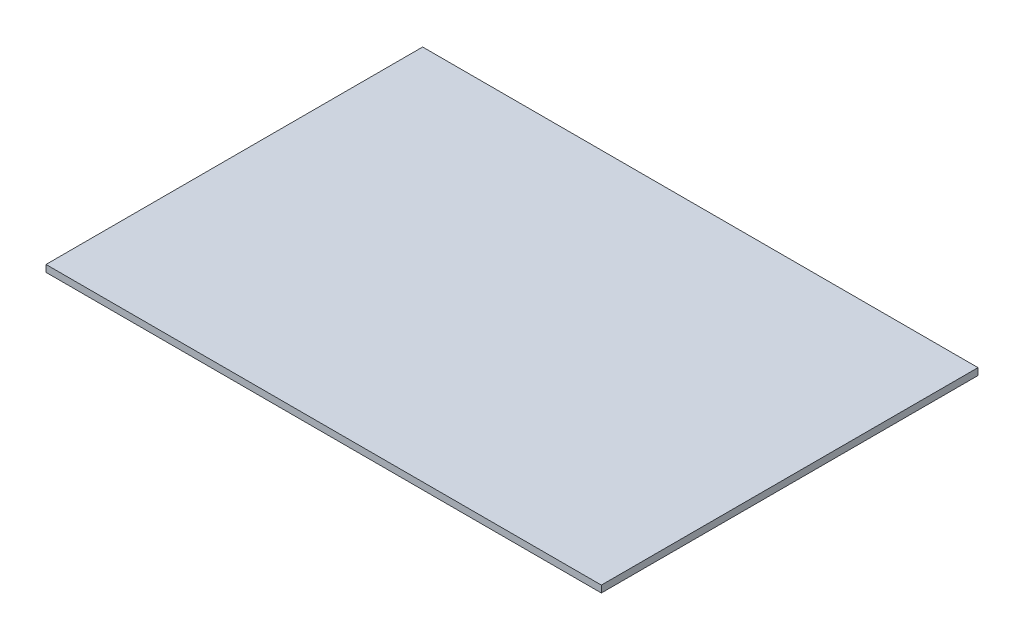
from build123d import *

# Parameters (mm, degrees)
SKETCH1_W           = 205.16159644
SKETCH1_H           = 139.144251052
BOSS_EXTRUDE1_DEPTH = 2.54


with BuildPart() as part:
    # Sketch1 → Boss-Extrude1 (new body)
    with BuildSketch(Plane(origin=(0, 0, 0), x_dir=(1, 0, 0), z_dir=(0, 1, 0))):
        Rectangle(SKETCH1_W, SKETCH1_H)
    extrude(amount=BOSS_EXTRUDE1_DEPTH)


solid = part.part
